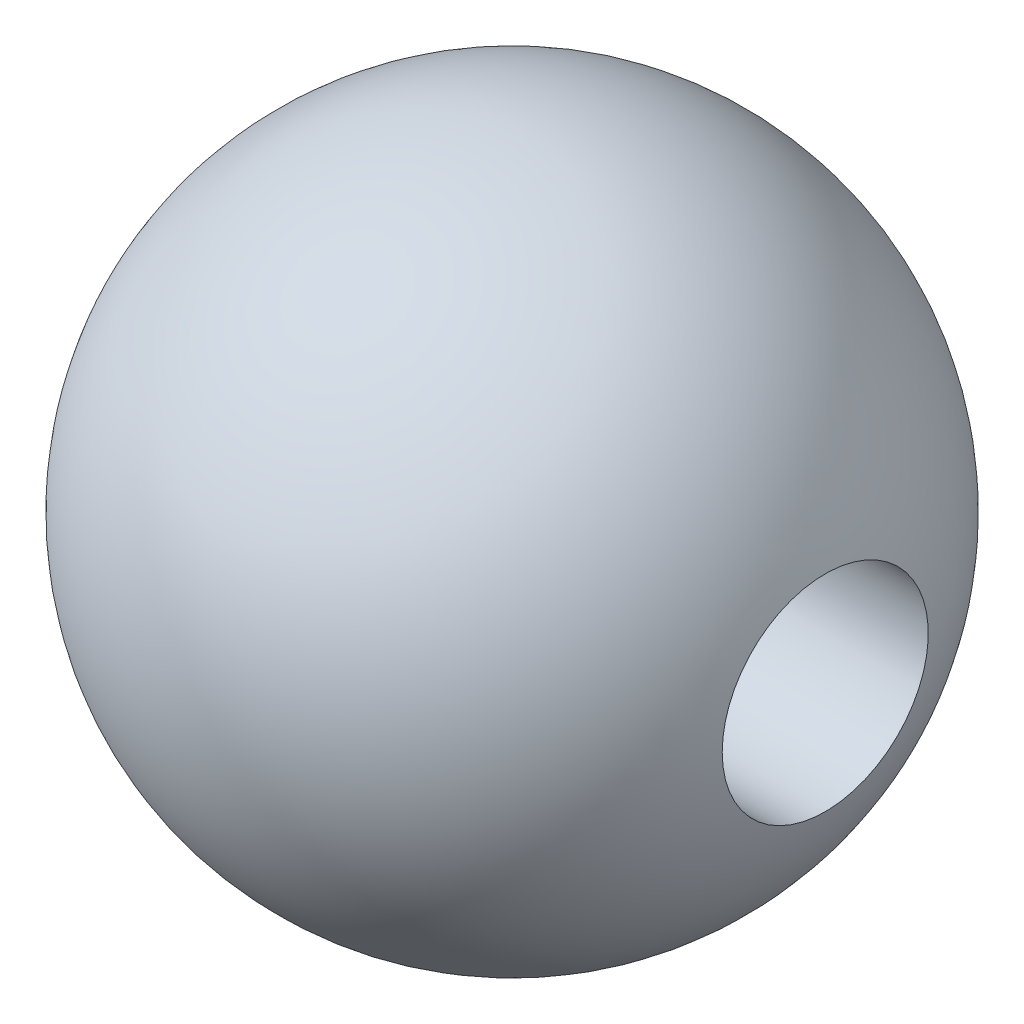
from build123d import *

# Parameters (mm, degrees)
SKETCH2_R          = 2.5
CUT_EXTRUDE1_DEPTH = 20


with BuildPart() as part:
    # Sketch1 one side → Revolve2 (revolve)
    with BuildSketch(Plane(origin=(0, 0, 0), x_dir=(1, 0, 0), z_dir=(0, 1, 0))):
        with BuildLine():
            Line((-7.106929648, -3.673084667), (7.106929648, 3.673084667))
            ThreePointArc((7.106929648, 3.673084667), (-3.673084667, 7.106929648), (-7.106929648, -3.673084667))
        make_face()
    revolve(axis=Axis((0, 0, 0), (0.8883662060497312, 0, -0.45913558340517086)))

    # Sketch2 → Cut-Extrude1 (cut)
    with BuildSketch(Plane(origin=(8, 0, 0), x_dir=(0, 0, -1), z_dir=(1, 0, 0))):
        with Locations(Location((0, 0, 0), (0, 0, 180))):
            Circle(SKETCH2_R)
    extrude(amount=-CUT_EXTRUDE1_DEPTH, mode=Mode.SUBTRACT)


solid = part.part
